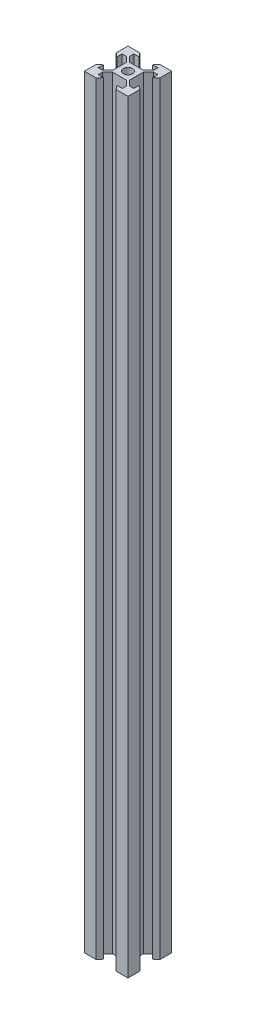
from build123d import *

# Parameters (mm, degrees)
SKETCH1_R           = 2.1
BOSS_EXTRUDE1_DEPTH = 350


with BuildPart() as part:
    # Sketch1 → Boss-Extrude1 (new body)
    with BuildSketch(Plane(origin=(0, 0, 0), x_dir=(1, 0, 0), z_dir=(0, 1, 0))):
        Polygon((0, 5.415), (0, 0), (4.5, 0), (5.42, 0), (6.875, 1.8), (4.5, 1.8), (4.5, 3.75), (6.85, 6.1), (13.15, 6.1), (15.5, 3.75), (15.5, 1.8), (13.147527473, 1.8), (14.58, 0), (20, 0), (20, 4.5), (20, 5.415), (18.2, 6.85), (18.2, 5.415), (18.2, 4.5), (16.25, 4.5), (13.9, 6.85), (13.9, 13.15), (16.25, 15.5), (18.2, 15.5), (18.2, 13.12), (20, 14.58), (20, 20), (15.5, 20), (14.58, 20), (13.125, 18.2), (15.5, 18.2), (15.5, 16.25), (13.15, 13.9), (6.85, 13.9), (4.5, 16.25), (4.5, 18.2), (6.875, 18.2), (5.42, 20), (4.5, 20), (0, 20), (0, 14.700042406), (0, 14.58), (1.8, 13.125), (1.8, 14.58), (1.8, 14.700042406), (1.8, 15.5), (3.75, 15.5), (6.1, 13.15), (6.1, 6.85), (3.75, 4.5), (1.8, 4.5), (1.8, 5.415), (1.8, 6.875), align=None)
        with Locations(Location((10, 10, 0), (0, 0, 270))):
            Circle(SKETCH1_R, mode=Mode.SUBTRACT)
    extrude(amount=BOSS_EXTRUDE1_DEPTH)


solid = part.part
